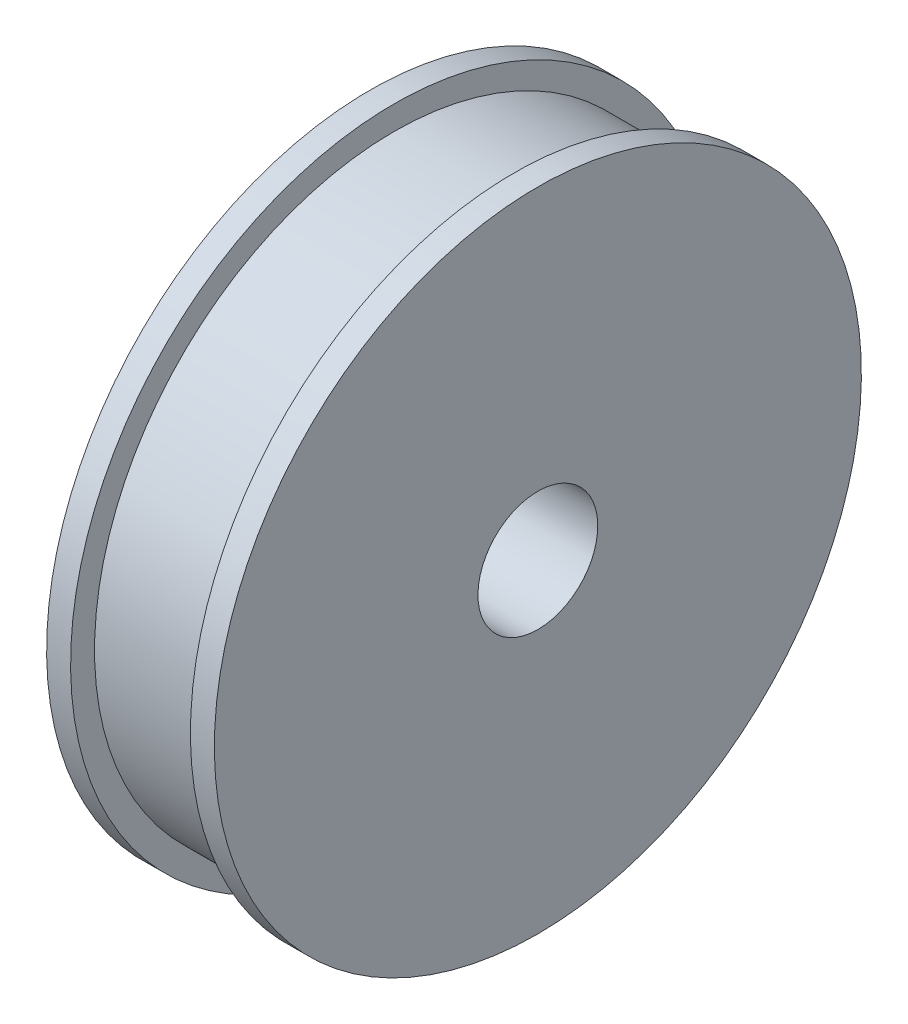
from build123d import *


with BuildPart() as part:
    # Sketch1 → Revolve1 (revolve)
    with BuildSketch(Plane.XY, mode=Mode.PRIVATE) as revolve1_sk:
        Polygon((7, 5), (7, 27), (5, 27), (5, 25), (-5, 25), (-5, 27), (-7, 27), (-7, 5), align=None)
    revolve(revolve1_sk.sketch.rotate(Axis((-7, 0, 0), (1, 0, 0)), 180), axis=Axis((-7, 0, 0), (1, 0, 0)))


solid = part.part
